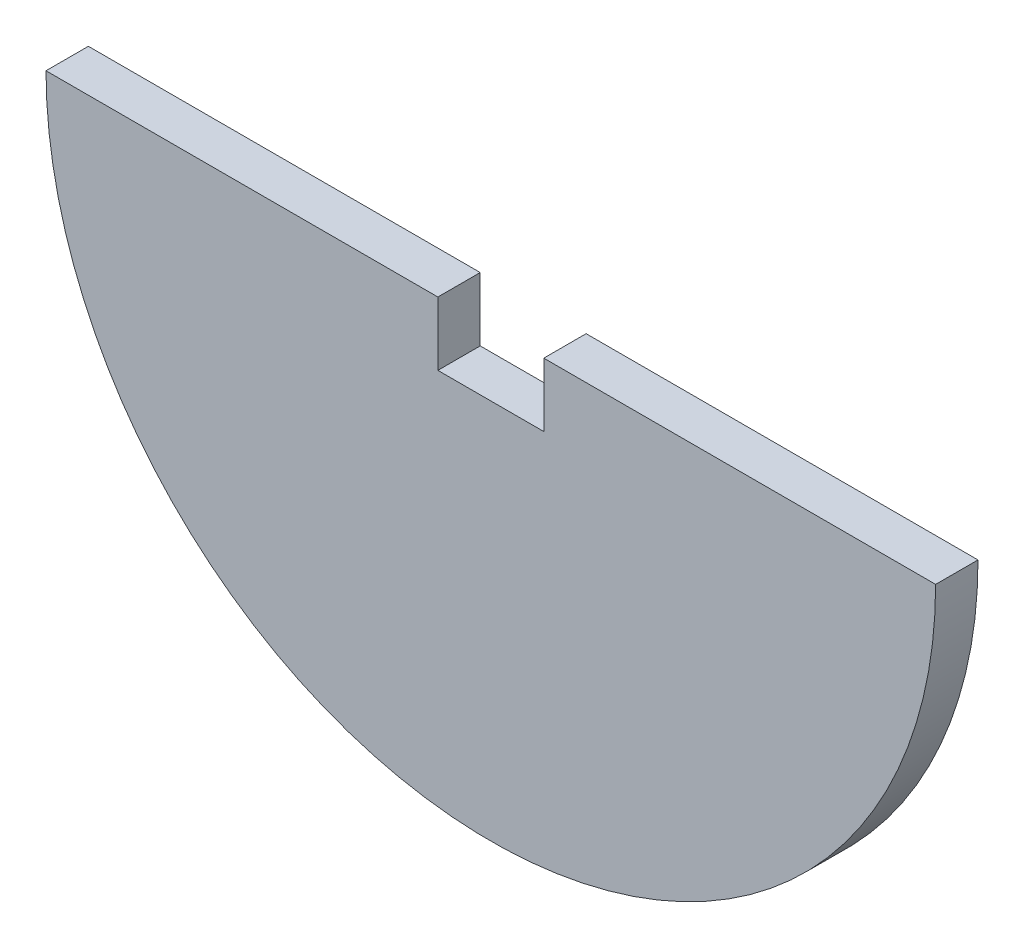
from build123d import *

# Parameters (mm, degrees)
EXTRUDE_2_DEPTH = 20
SCALE_1_SCALE   = 0.5


with BuildPart() as part:
    # 草图1 → 凸台-拉伸2 (new body)
    with BuildSketch(Plane.XY):
        with BuildLine():
            Line((-25, -30), (-25, 0))
            Line((-25, 0), (-210, 0))
            ThreePointArc((-210, 0), (0, -210), (210, 0))
            Line((210, 0), (25, 0))
            Line((25, 0), (25, -30))
            Line((25, -30), (0, -30))
            Line((0, -30), (-25, -30))
        make_face()
    extrude(amount=EXTRUDE_2_DEPTH)


with BuildPart() as part_1:
    # 缩放比例1: scaled about (0, -90.767415576, 10)
    add(part.part.scale(SCALE_1_SCALE).moved(Location((0, -45.383707788, 5))))


solid = part_1.part
